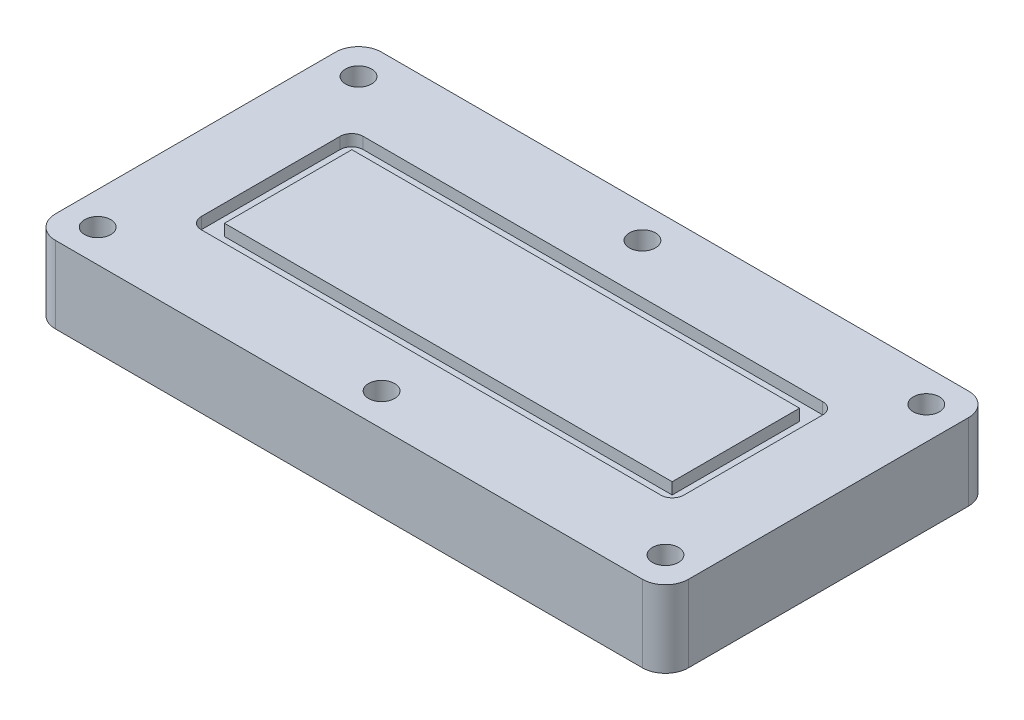
from build123d import *

# Parameters (mm, degrees)
SKETCH1_W           = 104.775
SKETCH1_H           = 53.975
BOSS_EXTRUDE1_DEPTH = 12.7
SKETCH3_W           = 79.883
SKETCH3_H           = 26.797
SKETCH3_W_2         = 74.1045
SKETCH3_H_2         = 21.082
CUT_EXTRUDE1_DEPTH  = 1.905
FILLET1_R           = 1.905
SKETCH4_R           = 2.159
CUT_EXTRUDE2_DEPTH  = 61.283209209
SKETCH8_R           = 3.6195
CUT_EXTRUDE3_DEPTH  = 4.572
FILLET2_R           = 3.81


with BuildPart() as part:
    # Sketch1 → Boss-Extrude1 (new body)
    with BuildSketch(Plane(origin=(0, 0, 0), x_dir=(1, 0, 0), z_dir=(0, 1, 0))):
        Rectangle(SKETCH1_W, SKETCH1_H)
    extrude(amount=BOSS_EXTRUDE1_DEPTH)

    # Sketch3 → Cut-Extrude1 (cut)
    with BuildSketch(Plane(origin=(0, 12.7, 0), x_dir=(1, 0, 0), z_dir=(0, 1, 0))):
        Rectangle(SKETCH3_W, SKETCH3_H)
        Rectangle(SKETCH3_W_2, SKETCH3_H_2, mode=Mode.SUBTRACT)
    extrude(amount=-CUT_EXTRUDE1_DEPTH, mode=Mode.SUBTRACT)

    # Fillet1
    fillet1_edges = [part.edges().sort_by_distance(p)[0] for p in [
        (39.9415, 11.7475, -13.3985),
        (39.9415, 11.7475, 13.3985),
        (-39.9415, 11.7475, 13.3985),
        (-39.9415, 11.7475, -13.3985),
    ]]
    fillet(fillet1_edges, radius=FILLET1_R)

    # Sketch4 → Cut-Extrude2 (cut, through all)
    with BuildSketch(Plane.XZ):
        with Locations(Location((-46.99, 21.59, 0), (0, 0, 270))):
            Circle(SKETCH4_R)
        with Locations(Location((46.99, 21.59, 0), (0, 0, 270))):
            Circle(SKETCH4_R)
        with Locations(Location((-46.99, -21.59, 0), (0, 0, 270))):
            Circle(SKETCH4_R)
        with Locations(Location((46.99, -21.59, 0), (0, 0, 270))):
            Circle(SKETCH4_R)
        with Locations(Location((0, 21.59, 0), (0, 0, 270))):
            Circle(SKETCH4_R)
        with Locations(Location((0, -21.59, 0), (0, 0, 270))):
            Circle(SKETCH4_R)
    extrude(amount=-CUT_EXTRUDE2_DEPTH, mode=Mode.SUBTRACT)

    # Sketch8 → Cut-Extrude3 (cut)
    with BuildSketch(Plane.XZ):
        with Locations(Location((-46.99, 21.59, 0), (0, 0, 270))):
            Circle(SKETCH8_R)
        with Locations(Location((0, 21.59, 0), (0, 0, 270))):
            Circle(SKETCH8_R)
        with Locations(Location((46.99, 21.59, 0), (0, 0, 270))):
            Circle(SKETCH8_R)
        with Locations(Location((46.99, -21.59, 0), (0, 0, 270))):
            Circle(SKETCH8_R)
        with Locations(Location((0, -21.59, 0), (0, 0, 270))):
            Circle(SKETCH8_R)
        with Locations(Location((-46.99, -21.59, 0), (0, 0, 270))):
            Circle(SKETCH8_R)
    extrude(amount=-CUT_EXTRUDE3_DEPTH, mode=Mode.SUBTRACT)

    # Fillet2
    fillet2_edges = [part.edges().sort_by_distance(p)[0] for p in [
        (52.3875, 6.35, 26.9875),
        (-52.3875, 6.35, 26.9875),
        (-52.3875, 6.35, -26.9875),
        (52.3875, 6.35, -26.9875),
    ]]
    fillet(fillet2_edges, radius=FILLET2_R)


solid = part.part
